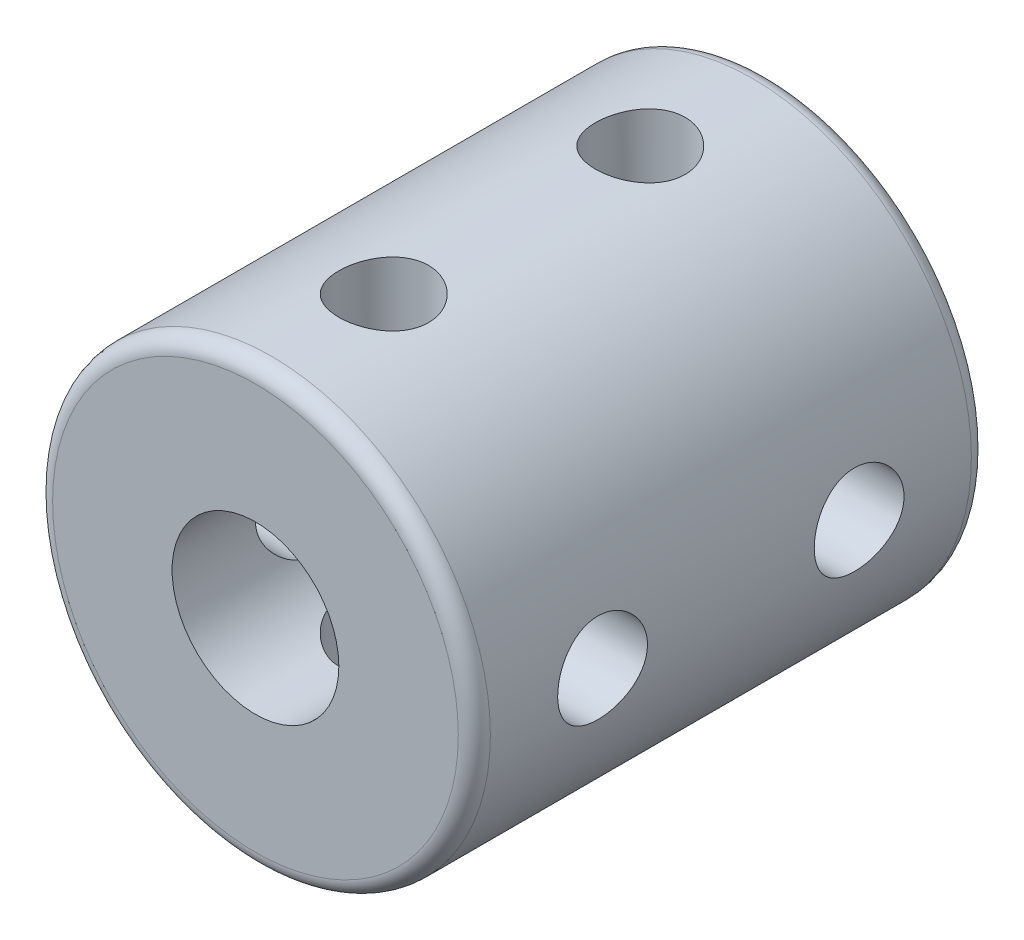
from build123d import *

# Parameters (mm, degrees)
SKETCH1_R               = 6.825
SKETCH1_R_2             = 2.6
BOSS_EXTRUDE1_DEPTH     = 16
SKETCH3_R               = 1.4
CUT_EXTRUDE2_DEPTH      = 10
CIRPATTERN1_COUNT       = 4
FILLET1_R               = 0.5
MIRROR1_COPY_1_SKETCH_R = 1.4
MIRROR1_COPY_1_DEPTH    = 10
MIRROR1_COPY_2_SKETCH_R = 1.4
MIRROR1_COPY_2_DEPTH    = 10
MIRROR1_COPY_3_SKETCH_R = 1.4
MIRROR1_COPY_3_DEPTH    = 10


with BuildPart() as part:
    # Sketch1 → Boss-Extrude1 (new body)
    with BuildSketch(Plane.XY):
        Circle(SKETCH1_R)
        Circle(SKETCH1_R_2, mode=Mode.SUBTRACT)
    extrude(amount=BOSS_EXTRUDE1_DEPTH)

    # Sketch3 → Cut-Extrude2 (cut)
    with BuildSketch(Plane(origin=(0, 0, 0), x_dir=(1, 0, 0), z_dir=(0, 1, 0))):
        with Locations(Location((0, -12, 0), (0, 0, 270))):
            Circle(SKETCH3_R)
    cut_extrude2 = extrude(amount=-CUT_EXTRUDE2_DEPTH, mode=Mode.SUBTRACT)

    # CirPattern1: Cut-Extrude2 ×4 about axis
    cirpattern1_axis = Axis((0, 0, 16), (0, 0, -1))
    for i in range(1, CIRPATTERN1_COUNT):
        add(cut_extrude2.rotate(cirpattern1_axis, i * 360 / CIRPATTERN1_COUNT), mode=Mode.SUBTRACT)

    # Fillet1
    fillet1_edges = [part.edges().sort_by_distance(p)[0] for p in [
        (-6.825, 0, 0),
        (-6.825, 0, 16),
        (-2.6, 0, 0),
    ]]
    fillet(fillet1_edges, radius=FILLET1_R)

    # Mirror1: Cut-Extrude2 across plane
    add(cut_extrude2.mirror(Plane.XY.offset(8)), mode=Mode.SUBTRACT)

    # Mirror1 copy 1 sketch → Mirror1 copy 1 (cut)
    with BuildSketch(Plane(origin=(0, 0, 16), x_dir=(0, -1, 0), z_dir=(1, 0, 0))):
        with Locations((0, 12)):
            Circle(MIRROR1_COPY_1_SKETCH_R)
    extrude(amount=-MIRROR1_COPY_1_DEPTH, mode=Mode.SUBTRACT)

    # Mirror1 copy 2 sketch → Mirror1 copy 2 (cut)
    with BuildSketch(Plane(origin=(0, 0, 16), x_dir=(-1, 0, 0), z_dir=(0, -1, 0))):
        with Locations((0, 12)):
            Circle(MIRROR1_COPY_2_SKETCH_R)
    extrude(amount=-MIRROR1_COPY_2_DEPTH, mode=Mode.SUBTRACT)

    # Mirror1 copy 3 sketch → Mirror1 copy 3 (cut)
    with BuildSketch(Plane(origin=(0, 0, 16), x_dir=(0, 1, 0), z_dir=(-1, 0, 0))):
        with Locations((0, 12)):
            Circle(MIRROR1_COPY_3_SKETCH_R)
    extrude(amount=-MIRROR1_COPY_3_DEPTH, mode=Mode.SUBTRACT)


solid = part.part
